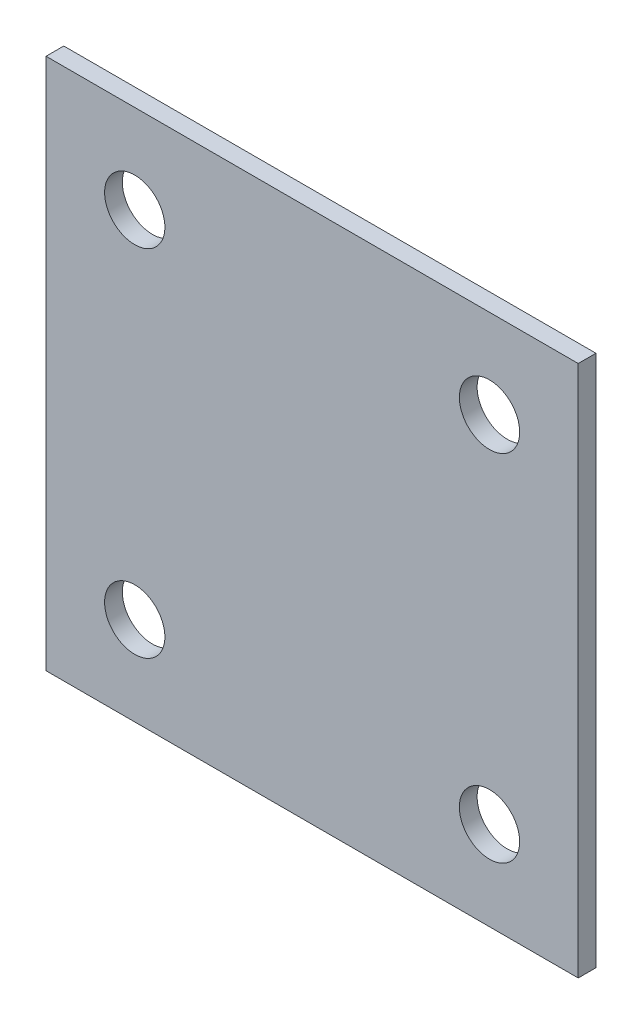
from build123d import *

# Parameters (mm, degrees)
ESQUISSE1_W        = 30
ESQUISSE1_H        = 30
BOSS_EXTRU_1_DEPTH = 1
D_GAGEMENT_M31_D   = 3.4


with BuildPart() as part:
    # Esquisse1 → Boss.-Extru.1 (new body)
    with BuildSketch(Plane.XY):
        Rectangle(ESQUISSE1_W, ESQUISSE1_H)
    extrude(amount=BOSS_EXTRU_1_DEPTH)

    # Dégagement M31 (through all)
    with Locations(Plane(origin=(0, 0, 0), x_dir=(-1, 0, 0), z_dir=(0, 0, -1))):
        with Locations((10, -10), (10, 10), (-10, 10), (-10, -10)):
            Hole(D_GAGEMENT_M31_D / 2)


solid = part.part
